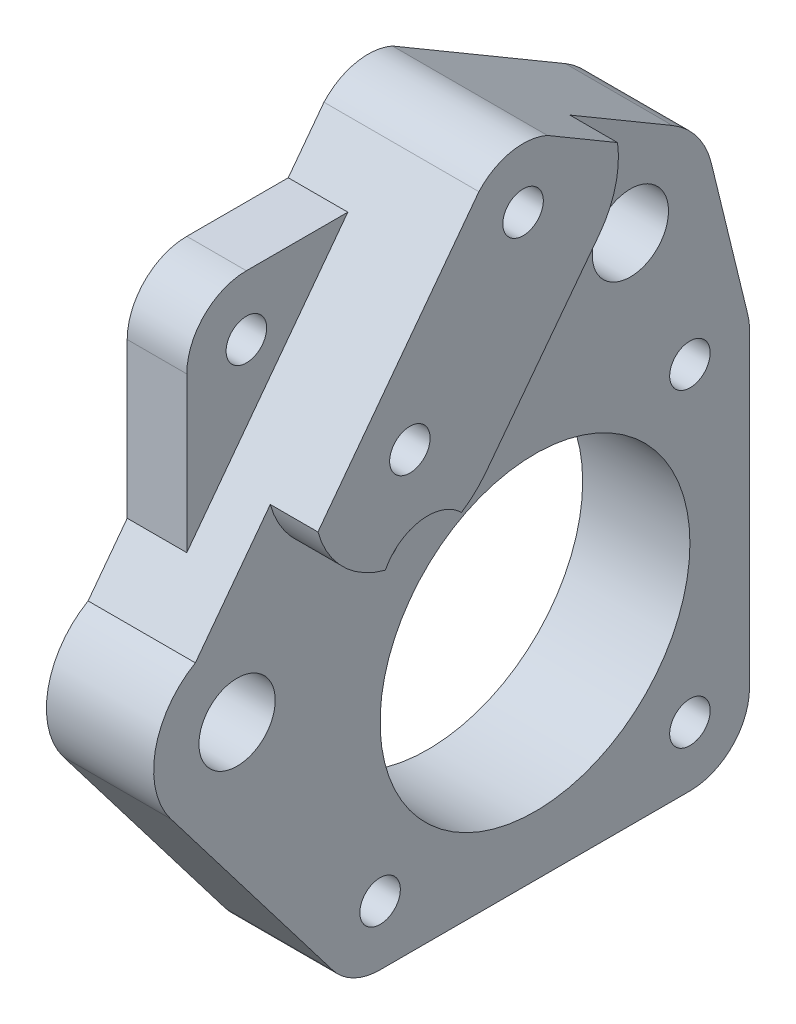
from build123d import *

# Parameters (mm, degrees)
BOSS_EXTRUDE1_DEPTH = 9
BOSS_EXTRUDE2_START = 4
BOSS_EXTRUDE2_DEPTH = 4
CUT_EXTRUDE1_DEPTH  = 4
BOSS_EXTRUDE3_DEPTH = 5
HOLE1_D             = 3.4
HOLE1_DEPTH         = 13.000025
HOLE2_D             = 3.4
HOLE3_D             = 3.4
HOLE4_D             = 26
HOLE5_D             = 3.4
HOLE6_D             = 3.4
HOLE7_D             = 3.4
HOLE8_D             = 3.4
HOLE9_D             = 6.4
HOLE10_D            = 6.4
FILLET1_R           = 5
FILLET2_R           = 5
FILLET3_R           = 5
FILLET4_R           = 5
FILLET5_R           = 7


with BuildPart() as part:
    # Sketch1 → Boss-Extrude1 (new body)
    with BuildSketch(Plane(origin=(0, 0, 0), x_dir=(0, 0, -1), z_dir=(1, 0, 0))):
        with BuildLine():
            Line((-16.707678896, 13.35456662), (-36.5, -12.990381057))
            ThreePointArc((-36.5, -12.990381057), (-39.864082969, -17.679837136), (-38.562263158, -23.302409299))
            Line((-38.562263158, -23.302409299), (-23.47214983, -43.052558883))
            Line((-23.47214983, -43.052558883), (10, -43.052558883))
            Line((10, -43.052558883), (10, -11.451281904))
            Line((10, -11.451281904), (6.09888089, 4.53429444))
            Line((6.09888089, 4.53429444), (-10.960043614, 14.564929128))
            ThreePointArc((-10.960043614, 14.564929128), (-14.030324678, 14.892691596), (-16.707678896, 13.35456662))
        make_face()
    extrude(amount=-BOSS_EXTRUDE1_DEPTH)

    # Sketch2 → Boss-Extrude2 (add)
    with BuildSketch(Plane(origin=(0, 0, 0), x_dir=(0, 0, -1), z_dir=(1, 0, 0)).offset(BOSS_EXTRUDE2_START)):
        with BuildLine():
            Line((-30.213330314, -4.622389094), (-16.707678896, 13.35456662))
            ThreePointArc((-16.707678896, 13.35456662), (-14.030324678, 14.892691596), (-10.960043614, 14.564929128))
            Line((-10.960043614, 14.564929128), (-5.076760086, 11.105562869))
            ThreePointArc((-5.076760086, 11.105562869), (-5.259937554, 7.977270822), (-6.630702447, 5.15933386))
            Line((-6.630702447, 5.15933386), (-16.130702447, -7.34066614))
            ThreePointArc((-16.130702447, -7.34066614), (-24.016200363, -10.355007095), (-30.213330314, -4.622389094))
        make_face()
    extrude(amount=-BOSS_EXTRUDE2_DEPTH)

    # Sketch3 → Cut-Extrude1 (cut)
    with BuildSketch(Plane(origin=(4, 0, 0), x_dir=(0, 0, -1), z_dir=(1, 0, 0))):
        with BuildLine():
            ThreePointArc((-24.560680199, -10.230045092), (-21.25899871, -10.403158596), (-18.1692777, -9.226428797))
            ThreePointArc((-18.1692777, -9.226428797), (-21.620500645, -8.100979585), (-24.560680199, -10.230045092))
        make_face()
    extrude(amount=-CUT_EXTRUDE1_DEPTH, mode=Mode.SUBTRACT)

    # Sketch4 → Boss-Extrude3 (add)
    with BuildSketch(Plane(origin=(-9, 0, 0), x_dir=(0, -1, 0), z_dir=(-1, 0, 0))):
        Polygon((-9.363394526, 33.219335817), (-9.363394526, 19.706149822), (8.623590229, 33.219335817), align=None)
    extrude(amount=-BOSS_EXTRUDE3_DEPTH)

    # Hole1
    with Locations(Plane.ZY.offset(9)):
        with Locations((28.219335817, 4.363394526)):
            Hole(HOLE1_D / 2, depth=HOLE1_DEPTH)

    # Hole2 (through all)
    with Locations(Plane(origin=(4, 0, 0), x_dir=(0, 0, -1), z_dir=(1, 0, 0))):
        with Locations((-13, 10)):
            Hole(HOLE2_D / 2)

    # Hole3 (through all)
    with Locations(Plane(origin=(4, 0, 0), x_dir=(0, 0, -1), z_dir=(1, 0, 0))):
        with Locations((-22.5, -2.5)):
            Hole(HOLE3_D / 2)

    # Hole4 (through all)
    with Locations(Plane(origin=(0, 0, 0), x_dir=(0, 0, -1), z_dir=(1, 0, 0))):
        with Locations((-8, -25.052558883)):
            Hole(HOLE4_D / 2)

    # Hole5 (through all)
    with Locations(Plane(origin=(0, 0, 0), x_dir=(0, 0, -1), z_dir=(1, 0, 0))):
        with Locations((5, -38.052558883)):
            Hole(HOLE5_D / 2)

    # Hole6 (through all)
    with Locations(Plane(origin=(0, 0, 0), x_dir=(0, 0, -1), z_dir=(1, 0, 0))):
        with Locations((-21, -38.052558883)):
            Hole(HOLE6_D / 2)

    # Hole7 (through all)
    with Locations(Plane(origin=(0, 0, 0), x_dir=(0, 0, -1), z_dir=(1, 0, 0))):
        with Locations((-21, -12.052558883)):
            Hole(HOLE7_D / 2)

    # Hole8 (through all)
    with Locations(Plane(origin=(0, 0, 0), x_dir=(0, 0, -1), z_dir=(1, 0, 0))):
        with Locations((5, -12.052558883)):
            Hole(HOLE8_D / 2)

    # Hole9 (through all)
    with Locations(Plane(origin=(0, 0, 0), x_dir=(0, 0, -1), z_dir=(1, 0, 0))):
        with Locations((0, 0)):
            Hole(HOLE9_D / 2)

    # Hole10 (through all)
    with Locations(Plane(origin=(0, 0, 0), x_dir=(0, 0, -1), z_dir=(1, 0, 0))):
        with Locations((-33, -19.052558883)):
            Hole(HOLE10_D / 2)

    # Fillet1
    fillet1_edges = [part.edges().sort_by_distance(p)[0] for p in [
        (-4.5, -43.052558883, -10),
    ]]
    fillet(fillet1_edges, radius=FILLET1_R)

    # Fillet2
    fillet2_edges = [part.edges().sort_by_distance(p)[0] for p in [
        (-4.5, -11.451281904, -10),
    ]]
    fillet(fillet2_edges, radius=FILLET2_R)

    # Fillet3
    fillet3_edges = [part.edges().sort_by_distance(p)[0] for p in [
        (-6.5, 9.363394526, 33.219335817),
    ]]
    fillet(fillet3_edges, radius=FILLET3_R)

    # Fillet4
    fillet4_edges = [part.edges().sort_by_distance(p)[0] for p in [
        (-4.5, -43.052558883, 23.47214983),
    ]]
    fillet(fillet4_edges, radius=FILLET4_R)

    # Fillet5
    fillet5_edges = [part.edges().sort_by_distance(p)[0] for p in [
        (-4.5, 4.53429444, -6.09888089),
    ]]
    fillet(fillet5_edges, radius=FILLET5_R)


solid = part.part
